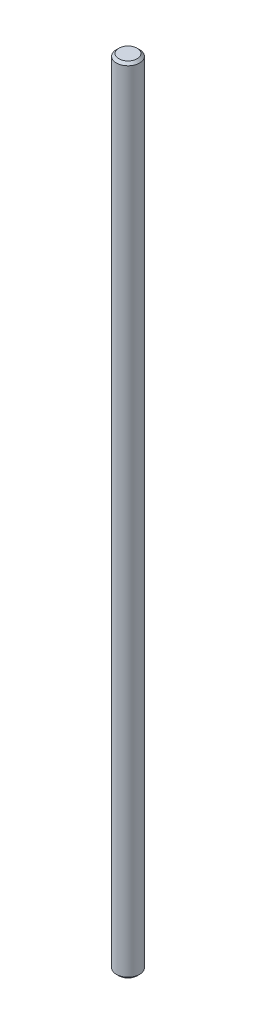
from build123d import *

# Parameters (mm, degrees)
M4_DIAMETER_SKETCH_R = 1.9
BOSS_EXTRUDE1_DEPTH  = 130
CHAMFER1_SIZE        = 0.4


with BuildPart() as part:
    # m4 diameter sketch → Boss-Extrude1 (new body)
    with BuildSketch(Plane(origin=(0, 0, 0), x_dir=(1, 0, 0), z_dir=(0, 1, 0))):
        with Locations(Location((0, 0, 0), (0, 0, 270))):
            Circle(M4_DIAMETER_SKETCH_R)
    extrude(amount=BOSS_EXTRUDE1_DEPTH)

    # Chamfer1
    chamfer1_edges = [part.edges().sort_by_distance(p)[0] for p in [
        (0, 0, -1.9),
        (0, 130, -1.9),
    ]]
    chamfer(chamfer1_edges, length=CHAMFER1_SIZE)


solid = part.part
